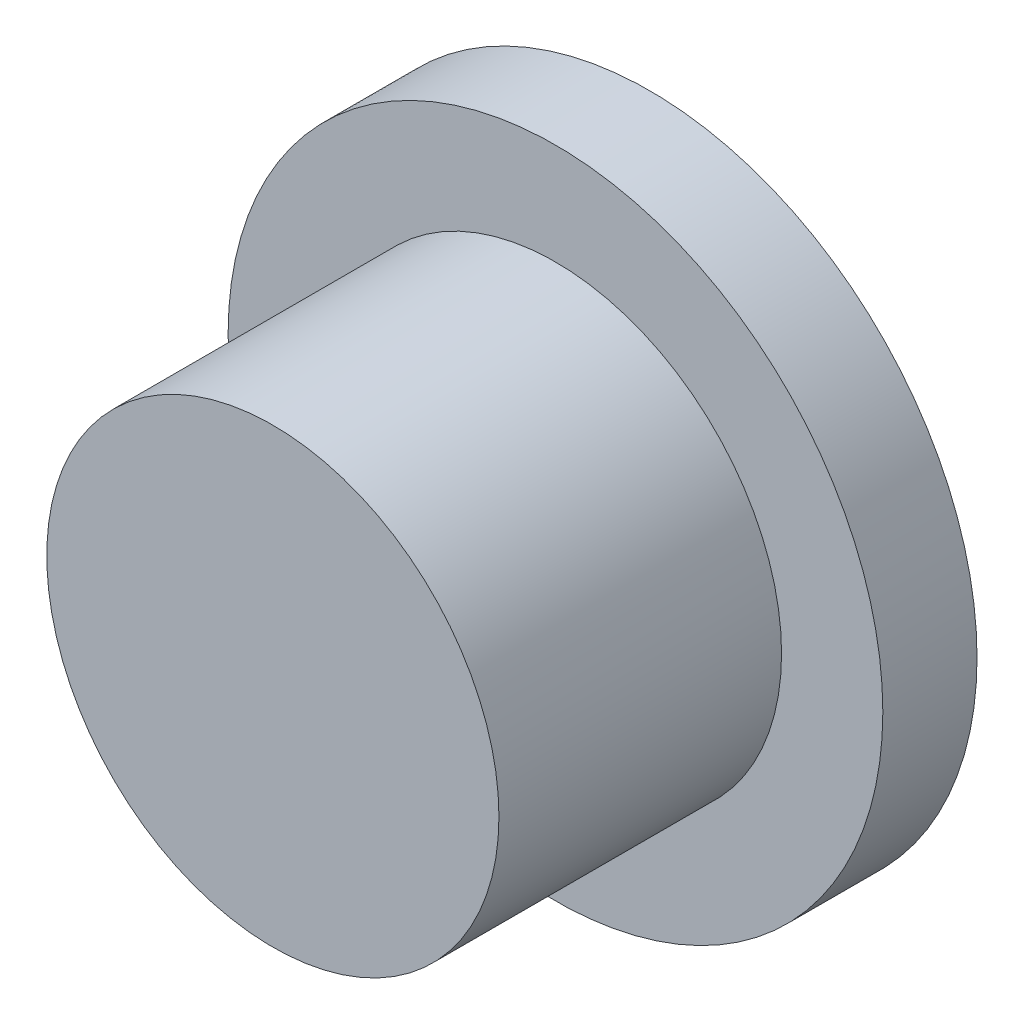
from build123d import *

# Parameters (mm, degrees)
IZIM1_R                     = 6.95
Y_KSEKLIK_EKSTR_ZYON1_DEPTH = 2
IZIM2_R                     = 4.8
Y_KSEKLIK_EKSTR_ZYON2_DEPTH = 6


with BuildPart() as part:
    # Çizim1 → Yükseklik-Ekstrüzyon1 (new body)
    with BuildSketch(Plane.XY):
        Circle(IZIM1_R)
    extrude(amount=Y_KSEKLIK_EKSTR_ZYON1_DEPTH)

    # Çizim2 → Yükseklik-Ekstrüzyon2 (add)
    with BuildSketch(Plane.XY.offset(2)):
        Circle(IZIM2_R)
    extrude(amount=Y_KSEKLIK_EKSTR_ZYON2_DEPTH)


solid = part.part
